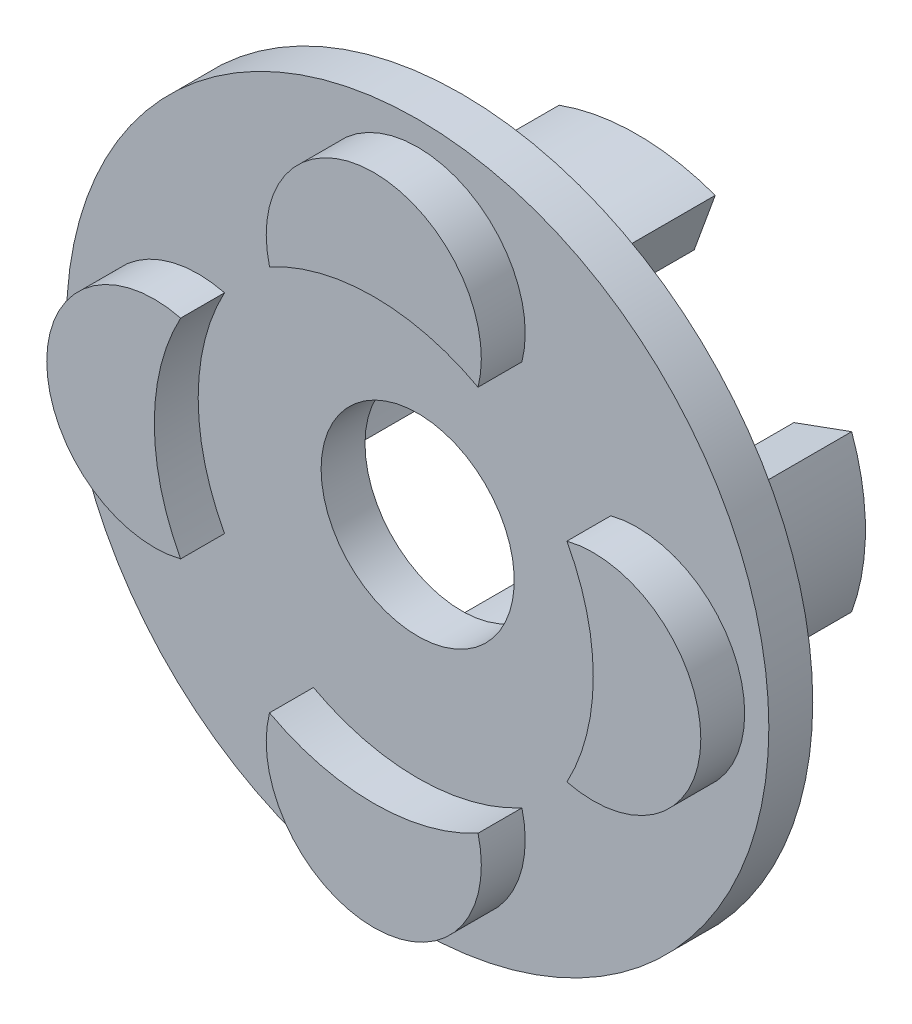
from build123d import *

# Parameters (mm, degrees)
SKETCH_1_R          = 40
EXTRUDE_1_DEPTH     = 5
EXTRUDE_2_DEPTH     = 20
SKETCH_3_R          = 11
CUT_EXTRUDE_1_DEPTH = 5
EXTRUDE_5_DEPTH     = 5


with BuildPart() as part:
    # 草图1 → 凸台-拉伸1 (new body)
    with BuildSketch(Plane.XY):
        Circle(SKETCH_1_R)
    extrude(amount=EXTRUDE_1_DEPTH)

    # 草图2 → 凸台-拉伸2 (add)
    with BuildSketch(Plane(origin=(0, 0, 0), x_dir=(-1, 0, 0), z_dir=(0, 0, -1))):
        with BuildLine():
            Line((-6.498382723, 17.854159795), (-8.892523726, 24.43200814))
            ThreePointArc((-8.892523726, 24.43200814), (0, 26), (8.892523726, 24.43200814))
            Line((8.892523726, 24.43200814), (6.498382723, 17.854159795))
            ThreePointArc((6.498382723, 17.854159795), (0, 19), (-6.498382723, 17.854159795))
        make_face()
        with BuildLine():
            Line((17.854159795, 6.498382723), (24.43200814, 8.892523726))
            ThreePointArc((24.43200814, 8.892523726), (26, 0), (24.43200814, -8.892523726))
            Line((24.43200814, -8.892523726), (17.854159795, -6.498382723))
            ThreePointArc((17.854159795, -6.498382723), (19, 0), (17.854159795, 6.498382723))
        make_face()
        with BuildLine():
            Line((6.498382723, -17.854159795), (8.892523726, -24.43200814))
            ThreePointArc((8.892523726, -24.43200814), (0, -26), (-8.892523726, -24.43200814))
            Line((-8.892523726, -24.43200814), (-6.498382723, -17.854159795))
            ThreePointArc((-6.498382723, -17.854159795), (0, -19), (6.498382723, -17.854159795))
        make_face()
        with BuildLine():
            Line((-17.854159795, -6.498382723), (-24.43200814, -8.892523726))
            ThreePointArc((-24.43200814, -8.892523726), (-26, 0), (-24.43200814, 8.892523726))
            Line((-24.43200814, 8.892523726), (-17.854159795, 6.498382723))
            ThreePointArc((-17.854159795, 6.498382723), (-19, 0), (-17.854159795, -6.498382723))
        make_face()
    extrude(amount=EXTRUDE_2_DEPTH)

    # 草图3 → 切除-拉伸1 (cut)
    with BuildSketch(Plane(origin=(0, 0, 0), x_dir=(-1, 0, 0), z_dir=(0, 0, -1))):
        Circle(SKETCH_3_R)
    extrude(amount=-CUT_EXTRUDE_1_DEPTH, mode=Mode.SUBTRACT)

    # 草图5 → 凸台-拉伸5 (add)
    with BuildSketch(Plane.XY.offset(5)):
        with BuildLine():
            ThreePointArc((11.876657713, 21.99875), (0, 37.25), (-11.876657713, 21.99875))
            ThreePointArc((-11.876657713, 21.99875), (0, 25), (11.876657713, 21.99875))
        make_face()
        with BuildLine():
            ThreePointArc((21.99875, -11.876657713), (37.25, 0), (21.99875, 11.876657713))
            ThreePointArc((21.99875, 11.876657713), (25, 0), (21.99875, -11.876657713))
        make_face()
        with BuildLine():
            ThreePointArc((-11.876657713, -21.99875), (0, -37.25), (11.876657713, -21.99875))
            ThreePointArc((11.876657713, -21.99875), (0, -25), (-11.876657713, -21.99875))
        make_face()
        with BuildLine():
            ThreePointArc((-21.99875, 11.876657713), (-37.25, 0), (-21.99875, -11.876657713))
            ThreePointArc((-21.99875, -11.876657713), (-25, 0), (-21.99875, 11.876657713))
        make_face()
    extrude(amount=EXTRUDE_5_DEPTH)


solid = part.part
